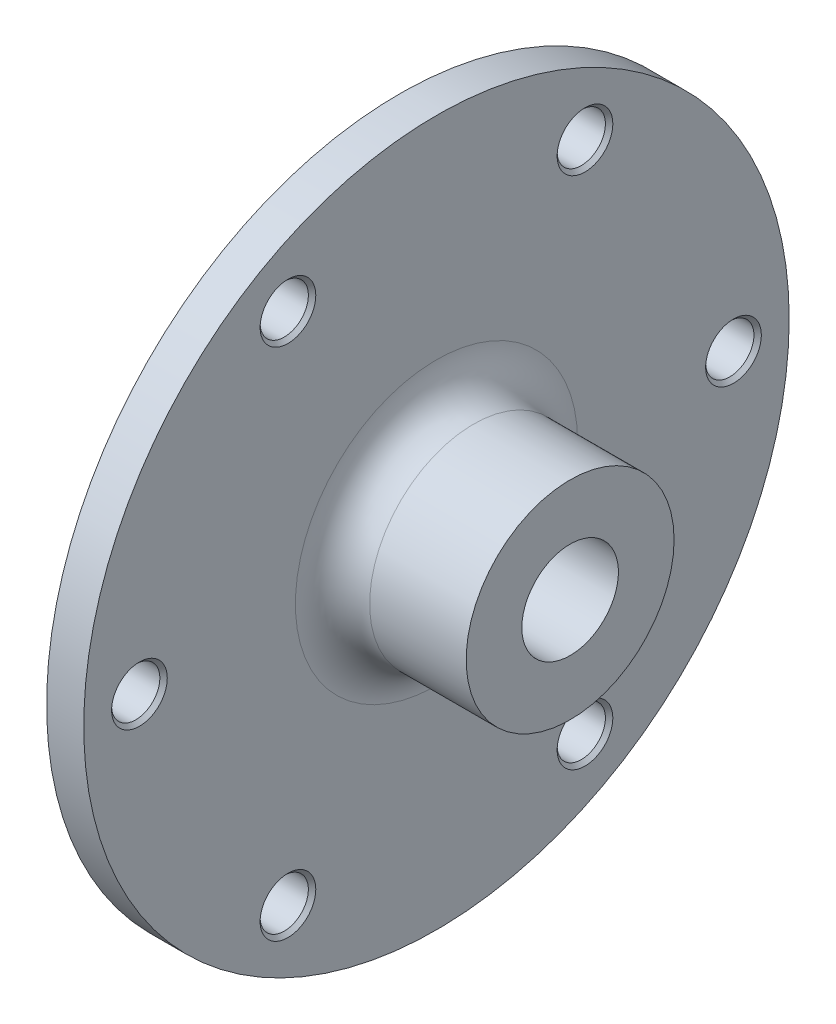
from build123d import *

# Parameters (mm, degrees)
FILLET1_R                                            = 5
CSK_FOR_M12_HEX_SOCKET_COUNTERSUNK_CAP_S_D           = 13
CSK_FOR_M12_HEX_SOCKET_COUNTERSUNK_CAP_S_CSINK_D     = 26
CSK_FOR_M12_HEX_SOCKET_COUNTERSUNK_CAP_S_CSINK_ANGLE = 90
CSK_FOR_M6_HEX_SOCKET_COUNTERSUNK_CAP_SC_D           = 6.5
CSK_FOR_M6_HEX_SOCKET_COUNTERSUNK_CAP_SC_CSINK_D     = 7.5
CSK_FOR_M6_HEX_SOCKET_COUNTERSUNK_CAP_SC_CSINK_ANGLE = 90
CIRPATTERN1_COUNT                                    = 6


with BuildPart() as part:
    # Sketch1 → Revolve1 (revolve)
    with BuildSketch(Plane.XY, mode=Mode.PRIVATE) as revolve1_sk:
        Polygon((0, 0), (-28, 0), (-28, 35), (-23, 35), (-23, 47.5), (-18, 47.5), (-18, 14), (0, 14), align=None)
    revolve(revolve1_sk.sketch.rotate(Axis((0, 0, 0), (-1, 0, 0)), 90), axis=Axis((0, 0, 0), (-1, 0, 0)))

    # Fillet1
    fillet1_edges = [part.edges().sort_by_distance(p)[0] for p in [
        (-18, 0, 14),
    ]]
    fillet(fillet1_edges, radius=FILLET1_R)

    # CSK for M12 Hex Socket Countersunk Cap Screw1 (through all)
    with Locations(Plane.ZY.offset(28)):
        with Locations((0, 0)):
            CounterSinkHole(CSK_FOR_M12_HEX_SOCKET_COUNTERSUNK_CAP_S_D / 2, CSK_FOR_M12_HEX_SOCKET_COUNTERSUNK_CAP_S_CSINK_D / 2, counter_sink_angle=CSK_FOR_M12_HEX_SOCKET_COUNTERSUNK_CAP_S_CSINK_ANGLE)

    # CSK for M6 Hex Socket Countersunk Cap Screw1 (through all)
    with Locations(Plane(origin=(-18, 0, 0), x_dir=(0, 0, -1), z_dir=(1, 0, 0))):
        with Locations((-40, 0)):
            csk_for_m6_hex_socket_countersunk_cap_sc = CounterSinkHole(CSK_FOR_M6_HEX_SOCKET_COUNTERSUNK_CAP_SC_D / 2, CSK_FOR_M6_HEX_SOCKET_COUNTERSUNK_CAP_SC_CSINK_D / 2, counter_sink_angle=CSK_FOR_M6_HEX_SOCKET_COUNTERSUNK_CAP_SC_CSINK_ANGLE)

    # CirPattern1: CSK for M6 Hex Socket Countersunk Cap Screw1 ×6 about axis
    cirpattern1_axis = Axis((0, 0, 0), (1, 0, 0))
    for i in range(1, CIRPATTERN1_COUNT):
        add(csk_for_m6_hex_socket_countersunk_cap_sc.rotate(cirpattern1_axis, i * 360 / CIRPATTERN1_COUNT), mode=Mode.SUBTRACT)


solid = part.part
